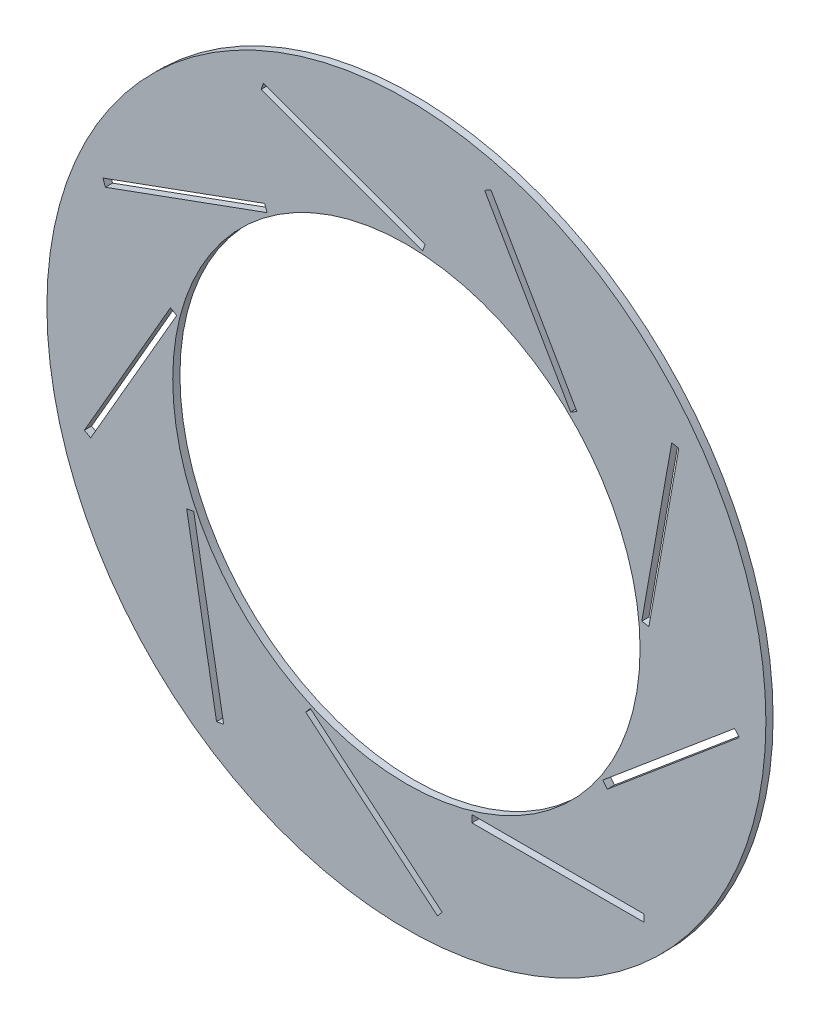
from build123d import *

# Parameters (mm, degrees)
SKETCH1_R         = 150
SKETCH1_R_2       = 97.5
SHROUD_DEPTH      = 3
SKETCH2_W         = 71.782300335
SKETCH2_H         = 3
BLADE_SLOTS_DEPTH = 3


with BuildPart() as part:
    # Sketch1 → Shroud (new body)
    with BuildSketch(Plane.XY):
        Circle(SKETCH1_R)
        Circle(SKETCH1_R_2, mode=Mode.SUBTRACT)
    extrude(amount=SHROUD_DEPTH)

    # Sketch2 → Blade_slots (cut)
    with BuildSketch(Plane.XY):
        with Locations((63.2155163, -96.418141453)):
            Rectangle(SKETCH2_W, SKETCH2_H)
        Polygon((83.872246927, -57.445884148), (138.860679213, -11.305110898), (136.932316384, -9.006977568), (81.943884098, -55.147750818), align=None)
        Polygon((101.175371248, 9.90594079), (113.64023689, 80.597706689), (110.685813631, 81.118651222), (98.220947989, 10.426885323), align=None)
        Polygon((71.137414923, 72.62266594), (35.246264756, 134.787961572), (32.648188544, 133.287961572), (68.539338712, 71.12266594), align=None)
        Polygon((7.813471551, 101.358438585), (-59.639826377, 125.909431234), (-60.665886807, 123.090353372), (6.787411121, 98.539360723), align=None)
        Polygon((-59.166481997, 82.667471343), (-126.619779924, 58.116478695), (-125.593719494, 55.297400832), (-58.140421567, 79.848393481), align=None)
        Polygon((-98.461781056, 25.295475513), (-134.352931224, -36.869820119), (-131.754855012, -38.369820119), (-95.863704845, 23.795475513), align=None)
        Polygon((-91.685718479, -43.912554438), (-79.220852837, -114.604320337), (-76.266429578, -114.083375804), (-88.73129522, -43.391609905), align=None)
        Polygon((-42.008889252, -92.573412133), (12.979543034, -138.714185383), (14.907905863, -136.416052054), (-40.080526423, -90.275278804), align=None)
    extrude(amount=BLADE_SLOTS_DEPTH, mode=Mode.SUBTRACT)


solid = part.part
